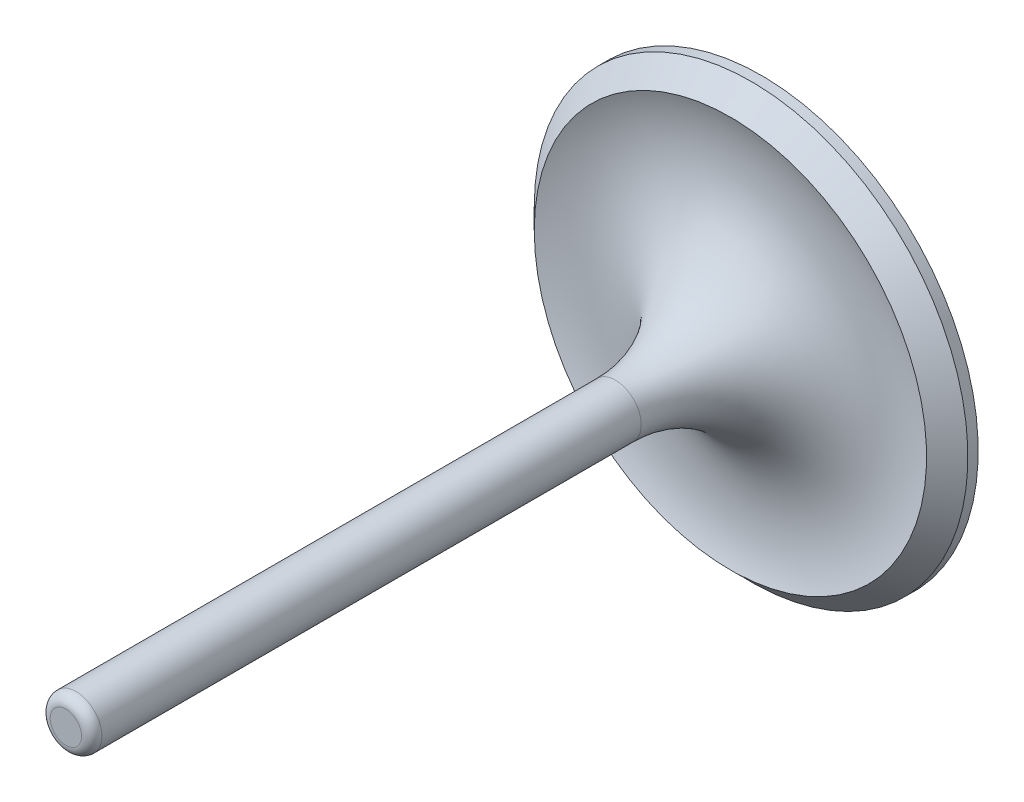
from build123d import *

# Parameters (mm, degrees)
FILLET1_R = 1.25


with BuildPart() as part:
    # Sketch1 → Revolve1 (revolve)
    with BuildSketch(Plane.YZ, mode=Mode.PRIVATE) as revolve1_sk:
        with BuildLine():
            Line((0, 0), (0, 85.55))
            Line((0, 85.55), (3.18, 85.55))
            Line((3.18, 85.55), (3.18, 17.954698654))
            ThreePointArc((3.18, 17.954698654), (9.896609701, 5.315721242), (24.13, 3.81))
            Line((24.13, 3.81), (26.67, 1.27))
            Line((26.67, 1.27), (26.67, 0))
            Line((26.67, 0), (0, 0))
        make_face()
    revolve(revolve1_sk.sketch.rotate(Axis((0, 0, 0), (0, 0, 1)), 90), axis=Axis((0, 0, 0), (0, 0, 1)))

    # Fillet1
    fillet1_edges = [part.edges().sort_by_distance(p)[0] for p in [
        (3.18, 0, 85.55),
    ]]
    fillet(fillet1_edges, radius=FILLET1_R)


solid = part.part
